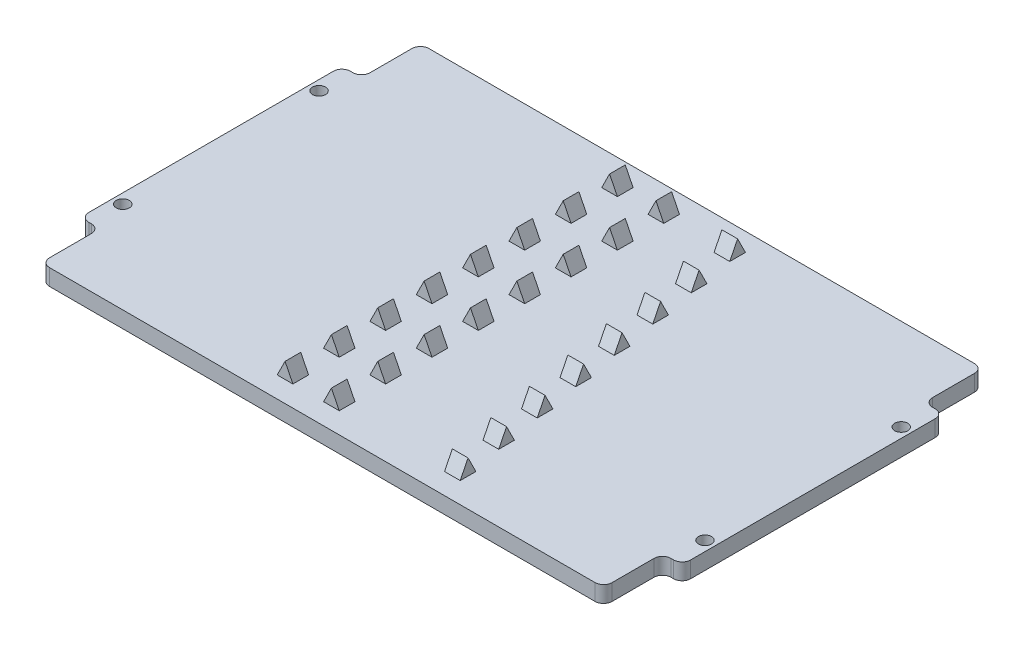
from build123d import *

# Parameters (mm, degrees)
SKETCH1_W            = 109.22
SKETCH1_H            = 73.66
BOSS_EXTRUDE1_DEPTH  = 3.175
BOSS_EXTRUDE3_DEPTH  = 1.524
LPATTERN1_COUNT      = 2
LPATTERN1_PITCH      = 9.000000034
LPATTERN1_COUNT_DIR2 = 8
LPATTERN1_PITCH_DIR2 = 9.000000034
SKETCH3_W            = 3.81
SKETCH3_H            = 50.8
SKETCH3_R            = 1.27
BOSS_EXTRUDE2_DEPTH  = 3.175
FILLET1_R            = 1.651
BOSS_EXTRUDE4_START  = 8.999982
BOSS_EXTRUDE4_DEPTH  = 3.048
BOSS_EXTRUDE5_START  = 10.523982
BOSS_EXTRUDE5_DEPTH  = 3.048
BOSS_EXTRUDE6_START  = 12.047982
BOSS_EXTRUDE6_DEPTH  = 3.048
BOSS_EXTRUDE7_START  = 13.571982
BOSS_EXTRUDE7_DEPTH  = 3.048
BOSS_EXTRUDE8_START  = 15.095982
BOSS_EXTRUDE8_DEPTH  = 3.048
BOSS_EXTRUDE9_START  = 16.619982
BOSS_EXTRUDE9_DEPTH  = 3.048
BOSS_EXTRUDE10_START = 18.143982
BOSS_EXTRUDE10_DEPTH = 3.048
BOSS_EXTRUDE11_START = 19.667982
BOSS_EXTRUDE11_DEPTH = 3.048


with BuildPart() as part:
    # Sketch1 → Boss-Extrude1 (new body)
    with BuildSketch(Plane(origin=(0, 0, 0), x_dir=(1, 0, 0), z_dir=(0, 1, 0))):
        Rectangle(SKETCH1_W, SKETCH1_H)
    extrude(amount=-BOSS_EXTRUDE1_DEPTH)

    # Sketch2 → Boss-Extrude3 (add, symmetric)
    with BuildSketch(Plane.XY.offset(-31.75)):
        Polygon((-12.810000034, 0), (-11.286000034, 3.048), (-9.762000034, 0), (-11.286000034, 0), align=None)
    boss_extrude3 = extrude(amount=BOSS_EXTRUDE3_DEPTH, both=True)

    # LPattern1: Boss-Extrude3 2 × 8
    with Locations(*[(i * LPATTERN1_PITCH, 0, j * LPATTERN1_PITCH_DIR2) for i in range(LPATTERN1_COUNT) for j in range(LPATTERN1_COUNT_DIR2) if (i, j) != (0, 0)]):
        add(boss_extrude3)

    # Sketch3 → Boss-Extrude2 (add)
    # profile 1 of 2: a face of its own
    with BuildSketch(Plane(origin=(0, 0, 0), x_dir=(1, 0, 0), z_dir=(0, 1, 0))):
        with Locations((-56.515, 0)):
            Rectangle(SKETCH3_W, SKETCH3_H)
        with Locations(Location((-56.515, 19.05, 0), (0, 0, 270))):
            Circle(SKETCH3_R, mode=Mode.SUBTRACT)
        with Locations(Location((-56.515, -19.05, 0), (0, 0, 270))):
            Circle(SKETCH3_R, mode=Mode.SUBTRACT)
    # profile 2 of 2: a face of its own
    with BuildSketch(Plane(origin=(0, 0, 0), x_dir=(1, 0, 0), z_dir=(0, 1, 0))):
        with Locations((56.515, 0)):
            Rectangle(SKETCH3_W, SKETCH3_H)
        with Locations(Location((56.515, -19.05, 0), (0, 0, 90))):
            Circle(SKETCH3_R, mode=Mode.SUBTRACT)
        with Locations(Location((56.515, 19.05, 0), (0, 0, 90))):
            Circle(SKETCH3_R, mode=Mode.SUBTRACT)
    extrude(amount=-BOSS_EXTRUDE2_DEPTH)

    # Fillet1
    fillet1_edges = [part.edges().sort_by_distance(p)[0] for p in [
        (-54.61, -1.5875, -25.4),
        (-54.61, -1.5875, 25.4),
        (-58.42, -1.5875, 25.4),
        (-58.42, -1.5875, -25.4),
        (54.61, -1.5875, -25.4),
        (58.42, -1.5875, -25.4),
        (58.42, -1.5875, 25.4),
        (54.61, -1.5875, 25.4),
        (54.61, -1.5875, 36.83),
        (-54.61, -1.5875, 36.83),
        (-54.61, -1.5875, -36.83),
        (54.61, -1.5875, -36.83),
    ]]
    fillet(fillet1_edges, radius=FILLET1_R)

    # Sketch4 → Boss-Extrude4 (add)
    with BuildSketch(Plane(origin=(0, 0, 0), x_dir=(0, 0, -1), z_dir=(1, 0, 0)).offset(BOSS_EXTRUDE4_START)):
        Polygon((30.226, 0), (33.274, 0), (31.75, 3.048), align=None)
    extrude(amount=BOSS_EXTRUDE4_DEPTH)

    # Sketch5 → Boss-Extrude5 (add)
    with BuildSketch(Plane(origin=(0, 0, 0), x_dir=(0, 0, -1), z_dir=(1, 0, 0)).offset(BOSS_EXTRUDE5_START)):
        Polygon((21.225999966, 0), (24.273999966, 0), (22.749999966, 3.048), align=None)
    extrude(amount=BOSS_EXTRUDE5_DEPTH)

    # Sketch6 → Boss-Extrude6 (add)
    with BuildSketch(Plane(origin=(0, 0, 0), x_dir=(0, 0, -1), z_dir=(1, 0, 0)).offset(BOSS_EXTRUDE6_START)):
        Polygon((12.225999932, 0), (15.273999932, 0), (13.749999932, 3.048), align=None)
    extrude(amount=BOSS_EXTRUDE6_DEPTH)

    # Sketch7 → Boss-Extrude7 (add)
    with BuildSketch(Plane(origin=(0, 0, 0), x_dir=(0, 0, -1), z_dir=(1, 0, 0)).offset(BOSS_EXTRUDE7_START)):
        Polygon((3.225999898, 0), (6.273999898, 0), (4.749999898, 3.048), align=None)
    extrude(amount=BOSS_EXTRUDE7_DEPTH)

    # Sketch8 → Boss-Extrude8 (add)
    with BuildSketch(Plane(origin=(0, 0, 0), x_dir=(0, 0, -1), z_dir=(1, 0, 0)).offset(BOSS_EXTRUDE8_START)):
        Polygon((-5.774000136, 0), (-2.726000136, 0), (-4.250000136, 3.048), align=None)
    extrude(amount=BOSS_EXTRUDE8_DEPTH)

    # Sketch9 → Boss-Extrude9 (add)
    with BuildSketch(Plane(origin=(0, 0, 0), x_dir=(0, 0, -1), z_dir=(1, 0, 0)).offset(BOSS_EXTRUDE9_START)):
        Polygon((-14.77400017, 0), (-11.72600017, 0), (-13.25000017, 3.048), align=None)
    extrude(amount=BOSS_EXTRUDE9_DEPTH)

    # Sketch10 → Boss-Extrude10 (add)
    with BuildSketch(Plane(origin=(0, 0, 0), x_dir=(0, 0, -1), z_dir=(1, 0, 0)).offset(BOSS_EXTRUDE10_START)):
        Polygon((-23.774000204, 0), (-20.726000204, 0), (-22.250000204, 3.048), align=None)
    extrude(amount=BOSS_EXTRUDE10_DEPTH)

    # Sketch11 → Boss-Extrude11 (add)
    with BuildSketch(Plane(origin=(0, 0, 0), x_dir=(0, 0, -1), z_dir=(1, 0, 0)).offset(BOSS_EXTRUDE11_START)):
        Polygon((-32.774000238, 0), (-29.726000238, 0), (-31.250000238, 3.048), align=None)
    extrude(amount=BOSS_EXTRUDE11_DEPTH)


solid = part.part
